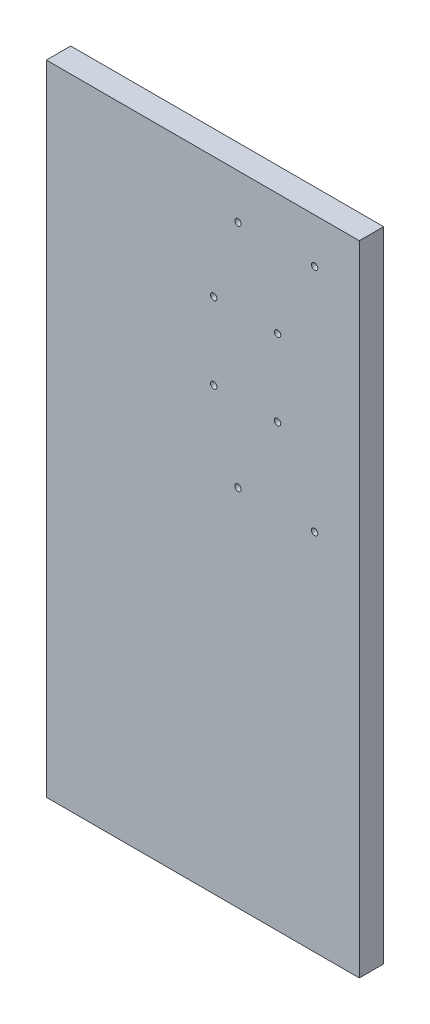
from build123d import *

# Parameters (mm, degrees)
SKETCH1_W                 = 245.05
SKETCH1_H                 = 500
BOSS_EXTRUDE1_DEPTH       = 19.05
F_5_0MM_DOWEL_HOLE1_D     = 5
F_5_0MM_DOWEL_HOLE1_DEPTH = 28.497848452
F_5_0MM_DOWEL_HOLE1_TIP   = 1.502151548


with BuildPart() as part:
    # Sketch1 → Boss-Extrude1 (new body)
    with BuildSketch(Plane.XY):
        with Locations((-122.525, 0)):
            Rectangle(SKETCH1_W, SKETCH1_H)
    extrude(amount=BOSS_EXTRUDE1_DEPTH)

    # Ø5.0mm Dowel Hole1
    with Locations(Plane(origin=(0, 0, 0), x_dir=(-1, 0, 0), z_dir=(0, 0, -1))):
        with Locations((35, 35), (95, 35), (114, 95), (64, 95), (64, 155), (35, 215), (95, 215), (114, 155)):
            Hole(F_5_0MM_DOWEL_HOLE1_D / 2, depth=F_5_0MM_DOWEL_HOLE1_DEPTH)
            with Locations((0, 0, -(F_5_0MM_DOWEL_HOLE1_DEPTH + F_5_0MM_DOWEL_HOLE1_TIP / 2))):  # 118° drill point
                Cone(0, F_5_0MM_DOWEL_HOLE1_D / 2, F_5_0MM_DOWEL_HOLE1_TIP, mode=Mode.SUBTRACT)


solid = part.part
